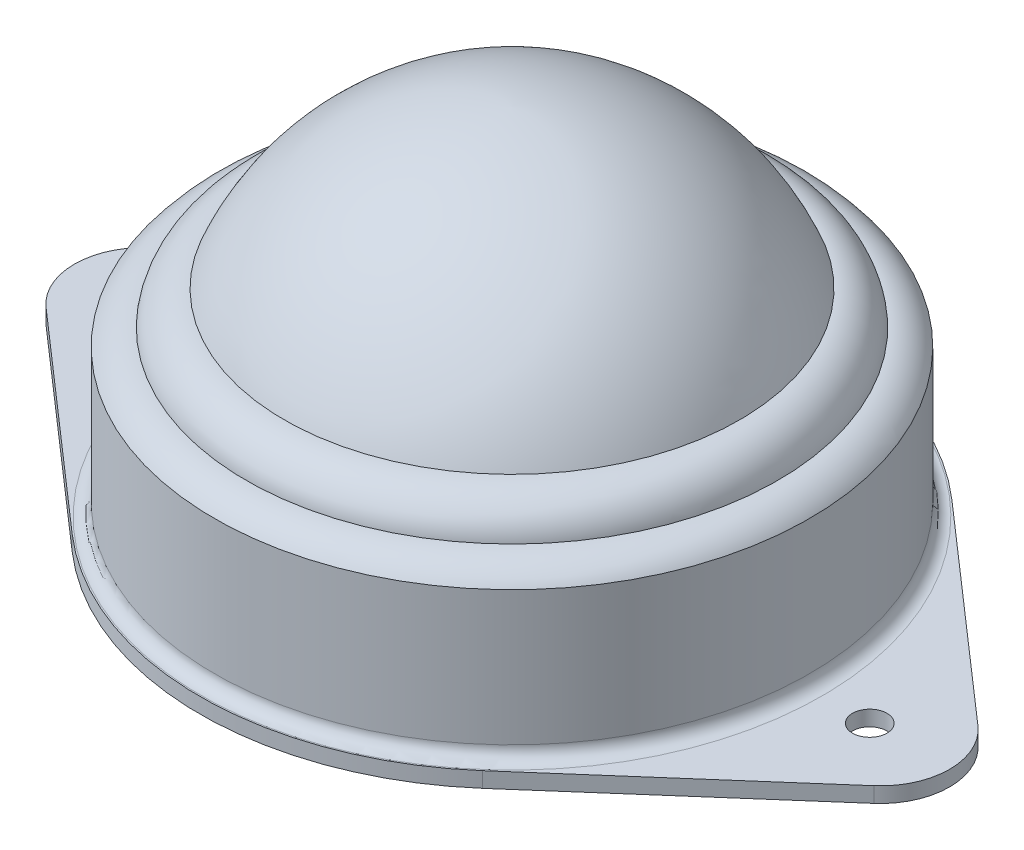
from build123d import *

# Parameters (mm, degrees)
EXTRUDE_1_DEPTH     = 1.2
SKETCH_3_R          = 1.35
CUT_EXTRUDE_1_DEPTH = 51.410936369
FILLET_1_R          = 1


with BuildPart() as part:
    # 草图1 → 旋转1 (revolve)
    with BuildSketch(Plane.XY, mode=Mode.PRIVATE) as revolve_1_sk:
        with BuildLine():
            Line((23.291058134, 0), (0, 0))
            Line((0, 0), (0, 27.8))
            ThreePointArc((0, 27.8), (10.740204899, 24.27796263), (17.822120499, 15.468693651))
            ThreePointArc((17.822120499, 15.468693651), (19.804057844, 14.720923562), (20.797914783, 12.850232746))
            ThreePointArc((20.797914783, 12.850232746), (22.211096182, 12.496546589), (23.291058134, 11.518866812))
            Line((23.291058134, 11.518866812), (23.291058134, 0))
        make_face()
    revolve(revolve_1_sk.sketch.rotate(Axis((0, 0, 0), (0, 1, 0)), 90), axis=Axis((0, 0, 0), (0, 1, 0)))

    # 草图2 → 凸台-拉伸1 (add)
    with BuildSketch(Plane.XZ):
        with BuildLine():
            Line((16.06932409, -18.361285992), (32.406325823, -4.063563293))
            ThreePointArc((32.406325823, -4.063563293), (34.25, 0), (32.406325823, 4.063563293))
            Line((32.406325823, 4.063563293), (16.06932409, 18.361285992))
            ThreePointArc((16.06932409, 18.361285992), (0, 24.4), (-16.06932409, 18.361285992))
            Line((-16.06932409, 18.361285992), (-32.406325823, 4.063563293))
            ThreePointArc((-32.406325823, 4.063563293), (-34.25, 0), (-32.406325823, -4.063563293))
            Line((-32.406325823, -4.063563293), (-16.06932409, -18.361285992))
            ThreePointArc((-16.06932409, -18.361285992), (0, -24.4), (16.06932409, -18.361285992))
        make_face()
    extrude(amount=EXTRUDE_1_DEPTH)

    # 草图3 → 切除-拉伸1 (cut, through all)
    with BuildSketch(Plane(origin=(0, 0, 0), x_dir=(1, 0, 0), z_dir=(0, 1, 0))):
        with Locations(Location((-28, 0, 0), (0, 0, 270))):
            Circle(SKETCH_3_R)
        with Locations(Location((28, 0, 0), (0, 0, 90))):
            Circle(SKETCH_3_R)
    extrude(amount=-CUT_EXTRUDE_1_DEPTH, mode=Mode.SUBTRACT)

    # 圆角1
    fillet_1_edges = [part.edges().sort_by_distance(p)[0] for p in [
        (0, 0, 23.291058134),
    ]]
    fillet(fillet_1_edges, radius=FILLET_1_R)


solid = part.part
